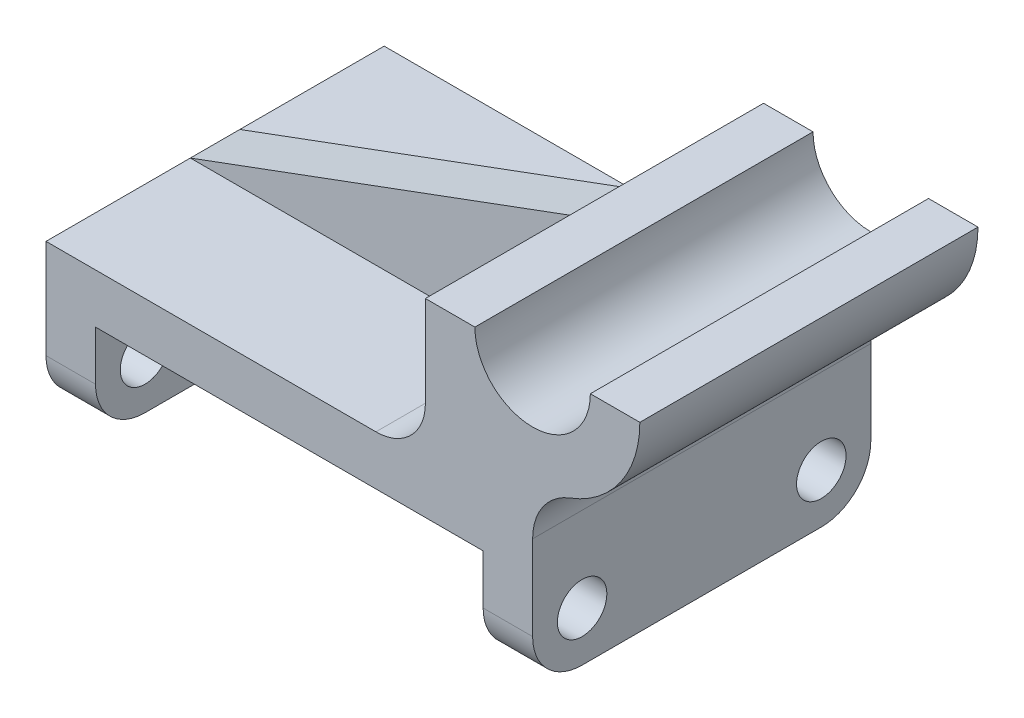
from build123d import *

# Parameters (mm, degrees)
BOSS_EXTRUDE1_DEPTH     = 41
BOSS_EXTRUDE2_DEPTH     = 6
CUT_EXTRUDE1_DEPTH      = 132.512198268
CUT_EXTRUDE1_DEPTH_BACK = 132.512198268
SKETCH2_R               = 6
FILLET1_R               = 12


with BuildPart() as part:
    # Sketch1 → Boss-Extrude1 (new, symmetric)
    with BuildSketch(Plane.XY):
        with BuildLine():
            ThreePointArc((118, 3.645195256), (120.497826292, 11.626423231), (127.1, 16.759691052))
            ThreePointArc((127.1, 16.759691052), (139.361179743, 26.29290272), (144, 41.115183246))
            Line((144, 41.115183246), (132, 41.115183246))
            ThreePointArc((132, 41.115183246), (118, 27.115183246), (104, 41.115183246))
            Line((104, 41.115183246), (92, 41.115183246))
            Line((92, 41.115183246), (92, 19.115183246))
            ThreePointArc((92, 19.115183246), (88.485281374, 10.629901872), (80, 7.115183246))
            Line((80, 7.115183246), (0, 7.115183246))
            Line((0, 7.115183246), (0, -28.884816754))
            Line((0, -28.884816754), (12, -28.884816754))
            Line((12, -28.884816754), (12, -4.884816754))
            Line((12, -4.884816754), (106, -4.884816754))
            Line((106, -4.884816754), (106, -28.884816754))
            Line((106, -28.884816754), (118, -28.884816754))
            Line((118, -28.884816754), (118, 3.645195256))
        make_face()
    extrude(amount=BOSS_EXTRUDE1_DEPTH, both=True)

    # Sketch1<3> → Boss-Extrude2 (add, symmetric)
    with BuildSketch(Plane.XY):
        with BuildLine():
            Line((92, 41.115183246), (0, 7.115183246))
            Line((0, 7.115183246), (80, 7.115183246))
            ThreePointArc((80, 7.115183246), (88.485281374, 10.629901872), (92, 19.115183246))
            Line((92, 19.115183246), (92, 41.115183246))
        make_face()
    extrude(amount=BOSS_EXTRUDE2_DEPTH, both=True)

    # Sketch2 → Cut-Extrude1 (cut, two sides: drawn at the far end of the back side and taken through both)
    with BuildSketch(Plane(origin=(118, 0, 0), x_dir=(0, 0, -1), z_dir=(1, 0, 0)).offset(-CUT_EXTRUDE1_DEPTH_BACK)):
        with Locations((-29, -16.884816754)):
            Circle(SKETCH2_R)
        with Locations((29, -16.884816754)):
            Circle(SKETCH2_R)
    extrude(amount=CUT_EXTRUDE1_DEPTH + CUT_EXTRUDE1_DEPTH_BACK, mode=Mode.SUBTRACT)

    # Fillet1
    fillet1_edges = [part.edges().sort_by_distance(p)[0] for p in [
        (6, -28.884816754, -41),
        (6, -28.884816754, 41),
        (112, -28.884816754, -41),
        (112, -28.884816754, 41),
    ]]
    fillet(fillet1_edges, radius=FILLET1_R)


solid = part.part
